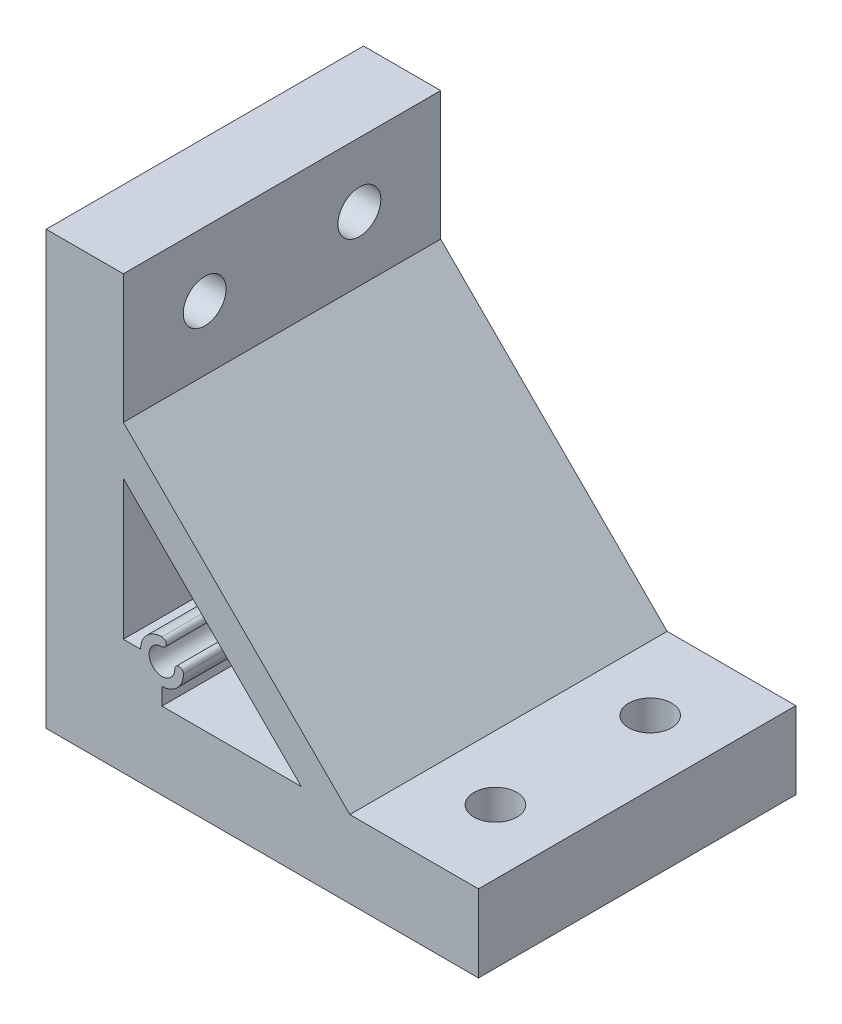
from build123d import *

# Parameters (mm, degrees)
BOSS_EXTRUDE2_DEPTH = 37
BOSS_EXTRUDE3_DEPTH = 37
CUT_EXTRUDE1_REACH  = 76.99
SKETCH2_R           = 2.5


with BuildPart() as part:
    # Sketch1 → Boss-Extrude2 (new body)
    with BuildSketch(Plane.XY):
        Polygon((35.402000333, 9), (9, 35.402000333), (9, 50.402000333), (0, 50.402000333), (0, 0), (50.402000333, 0), (50.402000333, 9), align=None)
        with BuildLine():
            ThreePointArc((13.5, 11), (11.732233047, 11.732233047), (11, 13.5))
            Line((11, 13.5), (9, 13.5))
            Line((9, 13.5), (9, 29.745146084))
            Line((9, 29.745146084), (29.745146084, 9))
            Line((29.745146084, 9), (13.5, 9))
            Line((13.5, 9), (13.5, 11))
        make_face(mode=Mode.SUBTRACT)
    extrude(amount=BOSS_EXTRUDE2_DEPTH)

    # Sketch1<4> → Boss-Extrude3 (add)
    with BuildSketch(Plane.XY):
        with BuildLine():
            ThreePointArc((13.5, 16), (11.732233047, 11.732233047), (16, 13.5))
            ThreePointArc((16, 13.5), (15.5, 14), (15, 13.5))
            ThreePointArc((15, 13.5), (12.439339828, 12.439339828), (13.5, 15))
            ThreePointArc((13.5, 15), (14, 15.5), (13.5, 16))
        make_face()
    extrude(amount=BOSS_EXTRUDE3_DEPTH)

    # Sketch2 → Cut-Extrude1 (cut, up to next)
    with BuildSketch(Plane(origin=(9, 0, 0), x_dir=(0, 0, -1), z_dir=(1, 0, 0)), mode=Mode.PRIVATE) as cut_extrude1_sk1:
        with Locations((-9.483, 42.902000333)):
            Circle(SKETCH2_R)
    cut_extrude1_tool1 = extrude(cut_extrude1_sk1.sketch, amount=-CUT_EXTRUDE1_REACH, mode=Mode.PRIVATE) & part.part
    # Sketch2 → Cut-Extrude1 (cut, up to next)
    with BuildSketch(Plane(origin=(9, 0, 0), x_dir=(0, 0, -1), z_dir=(1, 0, 0)), mode=Mode.PRIVATE) as cut_extrude1_sk2:
        with Locations((-27.517, 42.902000333)):
            Circle(SKETCH2_R)
    cut_extrude1_tool2 = extrude(cut_extrude1_sk2.sketch, amount=-CUT_EXTRUDE1_REACH, mode=Mode.PRIVATE) & part.part
    cut_extrude1_1 = cut_extrude1_tool1.solids().sort_by_distance((9, 42.902, 9.483))[0]
    add(cut_extrude1_1, mode=Mode.SUBTRACT)
    cut_extrude1_2 = cut_extrude1_tool2.solids().sort_by_distance((9, 42.902, 27.517))[0]
    add(cut_extrude1_2, mode=Mode.SUBTRACT)
    cut_extrude1 = cut_extrude1_1 + cut_extrude1_2  # Cut-Extrude1 as one shape, for the pattern or mirror that repeats it

    # Mirror1: Cut-Extrude1 across plane
    add(cut_extrude1.mirror(Plane(origin=(0, 0, 0), x_dir=(0, 0, 1), z_dir=(0.7071067811865464, -0.7071067811865488, 0))), mode=Mode.SUBTRACT)


solid = part.part
